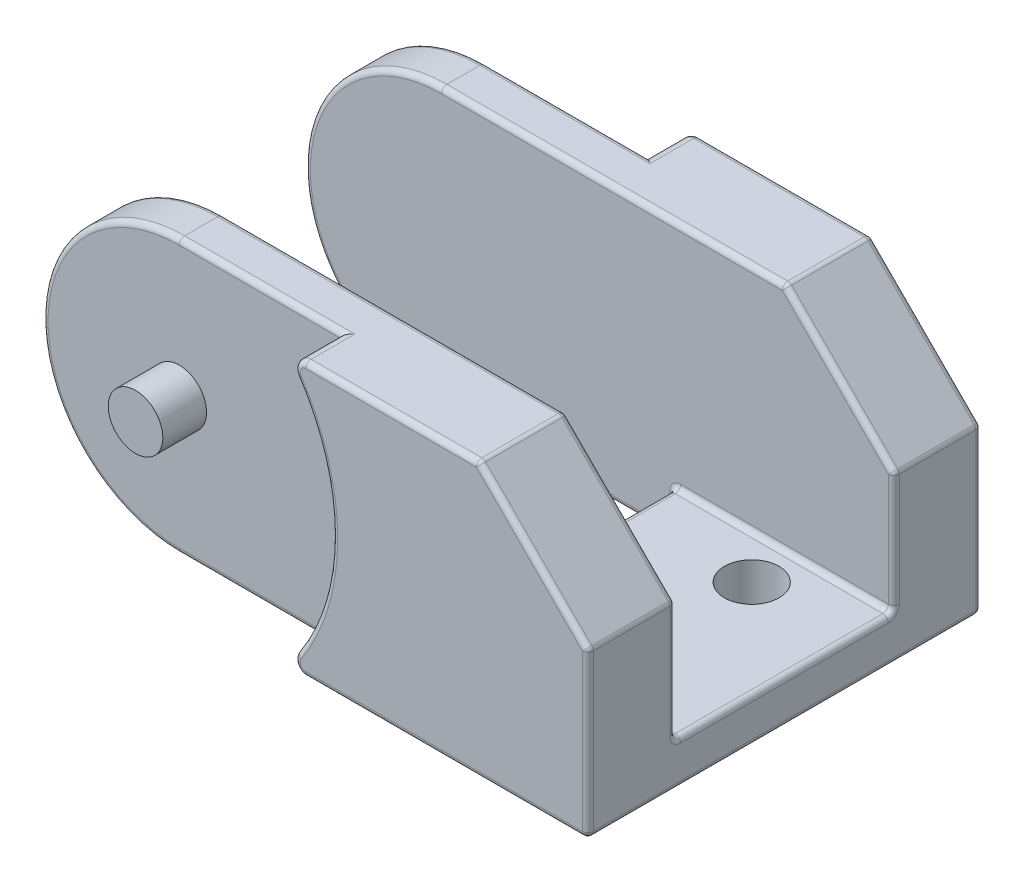
from build123d import *

# Parameters (mm, degrees)
BOSS_EXTRUDE1_DEPTH  = 4
BOSS_EXTRUDE7_DEPTH  = 4
SKETCH9_W            = 20
SKETCH9_H            = 28
BOSS_EXTRUDE8_DEPTH  = 4
BOSS_EXTRUDE9_DEPTH  = 4
FILLET4_R            = 1
BOSS_EXTRUDE11_DEPTH = 4
BOSS_EXTRUDE12_DEPTH = 4
SKETCH15_R           = 2.5
CUT_EXTRUDE4_DEPTH   = 4
CHAMFER2_SIZE        = 10
SKETCH11_R           = 2.5
BOSS_EXTRUDE13_DEPTH = 4
FILLET6_R            = 0.5
SCALE1_SCALE         = 0.5


with BuildPart() as part:
    # Sketch1 → Boss-Extrude1 (new body)
    with BuildSketch(Plane.XY):
        with BuildLine():
            ThreePointArc((0, 12.5), (-12.5, 0), (0, -12.5))
            Line((0, -12.5), (26.387505004, -12.5))
            ThreePointArc((26.387505004, -12.5), (22, 0), (26.387505004, 12.5))
            Line((26.387505004, 12.5), (0, 12.5))
        make_face()
    extrude(amount=BOSS_EXTRUDE1_DEPTH)

    # Sketch8 → Boss-Extrude7 (add)
    with BuildSketch(Plane(origin=(0, 0, 0), x_dir=(-1, 0, 0), z_dir=(0, 0, -1))):
        with BuildLine():
            Line((-26.387505004, 12.5), (-41.387505004, 12.5))
            Line((-41.387505004, 12.5), (-41.387505004, -12.5))
            Line((-41.387505004, -12.5), (-26.387505004, -12.5))
            ThreePointArc((-26.387505004, -12.5), (-22, 0), (-26.387505004, 12.5))
        make_face()
    extrude(amount=-BOSS_EXTRUDE7_DEPTH)


with BuildPart() as body_2:
    # Mirror3: mirrored copy
    add(part.part.mirror(Plane.XY.offset(14)))


with BuildPart() as part_1:
    add(part.part)

    add(body_2.part)  # Boss-Extrude8 merges body 2
    # Sketch9 → Boss-Extrude8 (add)
    with BuildSketch(Plane.XZ.offset(12.5)):
        with Locations((31.387505004, 14)):
            Rectangle(SKETCH9_W, SKETCH9_H)
    extrude(amount=-BOSS_EXTRUDE8_DEPTH)

    # Sketch1<4> → Boss-Extrude9 (add)
    with BuildSketch(Plane.XY):
        with BuildLine():
            ThreePointArc((13.612494996, 12.5), (18, 0), (13.612494996, -12.5))
            Line((13.612494996, -12.5), (40, -12.5))
            ThreePointArc((40, -12.5), (27.5, 0), (40, 12.5))
            Line((40, 12.5), (13.612494996, 12.5))
        make_face()
    boss_extrude9 = extrude(amount=-BOSS_EXTRUDE9_DEPTH)

    # Mirror4: Boss-Extrude9 across plane
    add(boss_extrude9.mirror(Plane.XY.offset(14)))

    # Fillet4
    fillet4_edges = [part_1.edges().sort_by_distance(p)[0] for p in [
        (13.612494996, -12.5, 30),
        (13.612494996, 12.5, 30),
        (13.612494996, -12.5, -2),
        (13.612494996, 12.5, -2),
    ]]
    fillet(fillet4_edges, radius=FILLET4_R)

    # Sketch13 → Boss-Extrude11 (add)
    with BuildSketch(Plane(origin=(0, 0, 0), x_dir=(-1, 0, 0), z_dir=(0, 0, -1))):
        with BuildLine():
            Line((-41.387505004, -12.5), (-40, -12.5))
            ThreePointArc((-40, -12.5), (-27.5, 0), (-40, 12.5))
            Line((-40, 12.5), (-41.387505004, 12.5))
            Line((-41.387505004, 12.5), (-41.387505004, -12.5))
        make_face()
    extrude(amount=BOSS_EXTRUDE11_DEPTH)

    # Sketch14 → Boss-Extrude12 (add)
    with BuildSketch(Plane.XY.offset(28)):
        with BuildLine():
            Line((40, -12.5), (41.387505004, -12.5))
            Line((41.387505004, -12.5), (41.387505004, 12.5))
            Line((41.387505004, 12.5), (40, 12.5))
            ThreePointArc((40, 12.5), (27.5, 0), (40, -12.5))
        make_face()
    extrude(amount=BOSS_EXTRUDE12_DEPTH)

    # Sketch15 → Cut-Extrude4 (cut)
    with BuildSketch(Plane(origin=(0, -8.5, 0), x_dir=(1, 0, 0), z_dir=(0, 1, 0))):
        with Locations((32.387505004, -8)):
            Circle(SKETCH15_R)
        with Locations((32.387505004, -20)):
            Circle(SKETCH15_R)
    extrude(amount=-CUT_EXTRUDE4_DEPTH, mode=Mode.SUBTRACT)

    # Chamfer2
    chamfer2_edges = [part_1.edges().sort_by_distance(p)[0] for p in [
        (41.387505004, 12.5, 0),
        (41.387505004, 12.5, 28),
    ]]
    chamfer(chamfer2_edges, length=CHAMFER2_SIZE)

    # Sketch11 → Boss-Extrude13 (add)
    with BuildSketch(Plane.XY.offset(28)):
        Circle(SKETCH11_R)
    boss_extrude13 = extrude(amount=BOSS_EXTRUDE13_DEPTH)

    # Mirror5: Boss-Extrude13 across plane
    add(boss_extrude13.mirror(Plane.XY.offset(14)))

    # Fillet6
    fillet6_edges = [part_1.edges().sort_by_distance(p)[0] for p in [
        (21.387505004, -12.5, 14),
        (7.785641695, -12.5, 28),
        (-12.5, 0, 28),
        (7.785641695, -12.5, 0),
        (-12.5, 0, 0),
        (28.479394197, -12.5, -4),
        (14.691618953, -11.975594866, -4),
        (18, 0, -4),
        (14.691618953, 11.975594866, -4),
        (28.479394197, -12.5, 32),
        (14.691618953, -11.975594866, 32),
        (14.691618953, 11.975594866, 32),
        (36.387505004, 7.5, 32),
        (7.785641695, 12.5, 28),
        (31.387505004, 12.5, 28),
        (23.479394197, 12.5, 32),
        (41.387505004, -12.5, 14),
        (41.387505004, -5, 32),
        (41.387505004, 2.5, 28),
        (41.387505004, -8.5, 14),
        (41.387505004, -5, -4),
        (7.785641695, 12.5, 0),
        (23.479394197, 12.5, -4),
        (31.387505004, 12.5, 0),
        (36.387505004, 7.5, -4),
        (41.387505004, 2.5, 0),
        (-12.5, 0, 24),
        (10.693752502, -12.5, 24),
        (21.387505004, -10.5, 24),
        (31.387505004, -8.5, 24),
        (41.387505004, -3, 24),
        (36.387505004, 7.5, 24),
        (15.693752502, 12.5, 24),
        (31.387505004, -8.5, 4),
        (21.387505004, -10.5, 4),
        (10.693752502, -12.5, 4),
        (-12.5, 0, 4),
        (15.693752502, 12.5, 4),
        (36.387505004, 7.5, 4),
        (41.387505004, -3, 4),
        (21.387505004, -8.5, 14),
        (18, 0, 32),
    ]]
    fillet(fillet6_edges, radius=FILLET6_R)


with BuildPart() as part_2:
    # Scale1: scaled about (0, 0, 0)
    add(part_1.part.scale(SCALE1_SCALE))


solid = part_2.part
